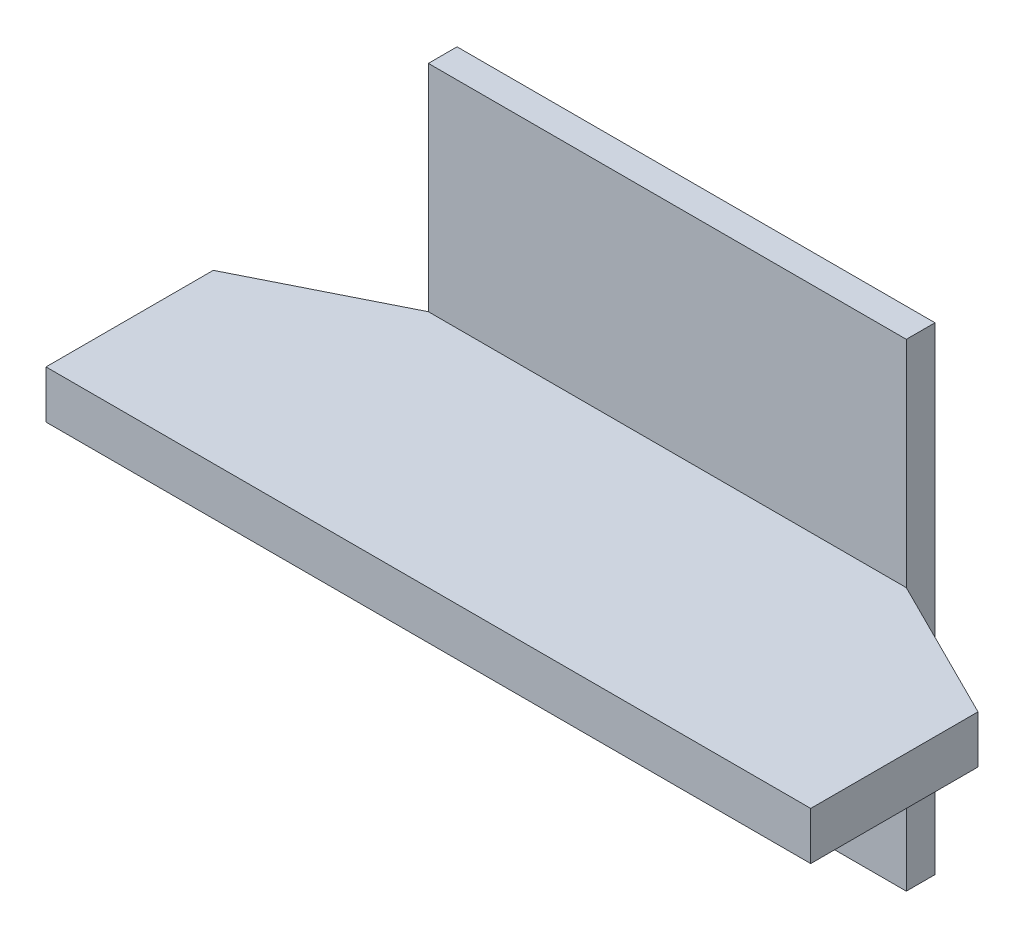
from build123d import *

# Parameters (mm, degrees)
SKETCH_1_W          = 200
SKETCH_1_H          = 200
EXTRUDE_1_DEPTH     = 12
SKETCH_3_W          = 320
SKETCH_3_H          = 20
EXTRUDE_3_DEPTH     = 100
CUT_EXTRUDE_4_DEPTH = 304.716973513


with BuildPart() as part:
    # 草图1 → 拉伸1 (new body)
    with BuildSketch(Plane.XY):
        with Locations((100, 100)):
            Rectangle(SKETCH_1_W, SKETCH_1_H)
    extrude(amount=EXTRUDE_1_DEPTH)

    # 草图3 → 拉伸3 (add)
    with BuildSketch(Plane.XY.offset(12)):
        with Locations((100, 100)):
            Rectangle(SKETCH_3_W, SKETCH_3_H)
    extrude(amount=EXTRUDE_3_DEPTH)

    # 草图4 → 拉伸4 (cut, through all)
    with BuildSketch(Plane.XZ.offset(-90)):
        Polygon((200, 12), (260, 42), (260, 12), align=None)
        Polygon((-60, 42), (0, 12), (-60, 12), align=None)
    extrude(amount=-CUT_EXTRUDE_4_DEPTH, mode=Mode.SUBTRACT)


solid = part.part
